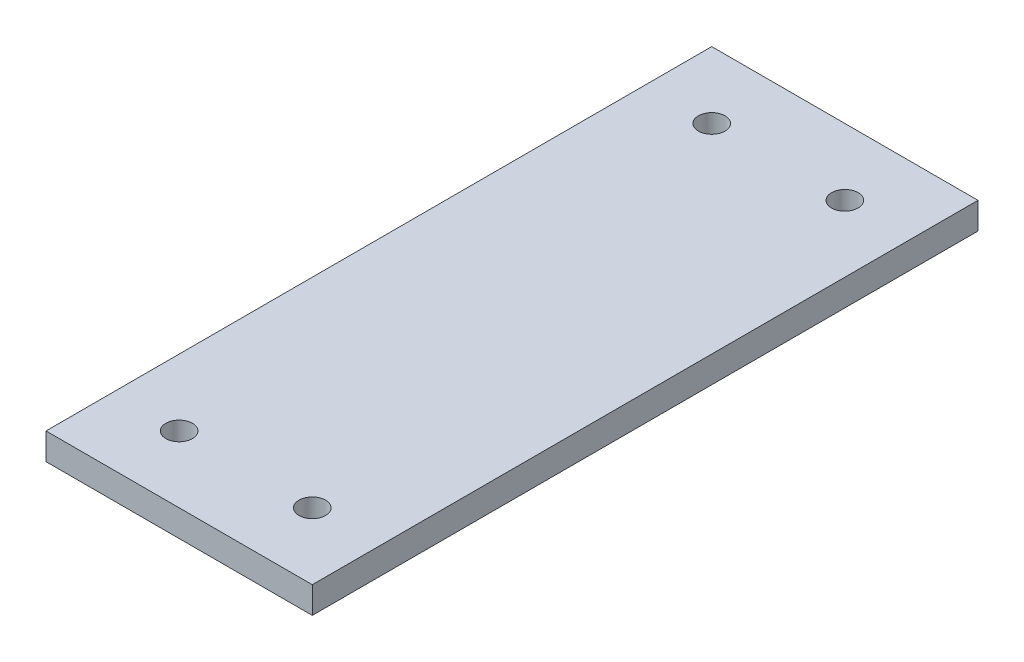
from build123d import *

# Parameters (mm, degrees)
ESQUISSE1_W             = 20
ESQUISSE1_H             = 50
BOSS_EXTRU_1_DEPTH      = 2
ESQUISSE2_R             = 1
ENL_V_MAT_EXTRU_1_DEPTH = 54.888774341


with BuildPart() as part:
    # Esquisse1 → Boss.-Extru.1 (new body)
    with BuildSketch(Plane(origin=(0, 0, 0), x_dir=(1, 0, 0), z_dir=(0, 1, 0))):
        with Locations((10, 25)):
            Rectangle(ESQUISSE1_W, ESQUISSE1_H)
    extrude(amount=BOSS_EXTRU_1_DEPTH)

    # Esquisse2 → Enlèv. mat.-Extru.1 (cut, through all)
    with BuildSketch(Plane(origin=(0, 2, 0), x_dir=(1, 0, 0), z_dir=(0, 1, 0))):
        with Locations(Location((5, 45, 0), (0, 0, 270))):
            Circle(ESQUISSE2_R)
        with Locations(Location((15, 45, 0), (0, 0, 270))):
            Circle(ESQUISSE2_R)
        with Locations(Location((15, 5, 0), (0, 0, 270))):
            Circle(ESQUISSE2_R)
        with Locations(Location((5, 5, 0), (0, 0, 270))):
            Circle(ESQUISSE2_R)
    extrude(amount=-ENL_V_MAT_EXTRU_1_DEPTH, mode=Mode.SUBTRACT)


solid = part.part
